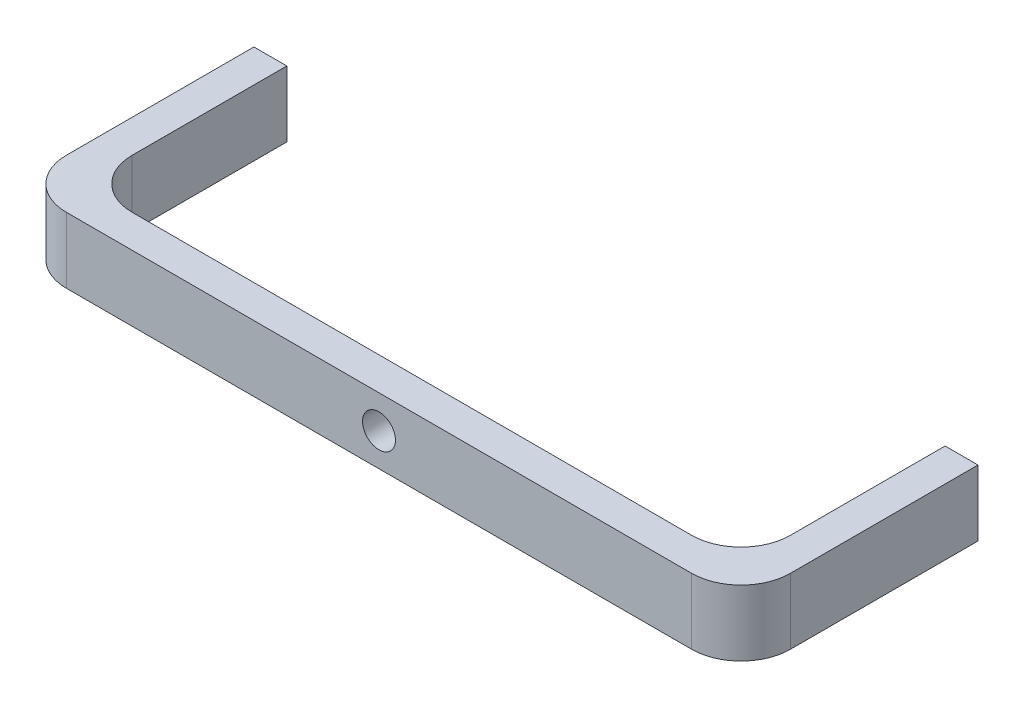
from build123d import *

# Parameters (mm, degrees)
BOSS_EXTRUDE1_DEPTH = 25.4
SKETCH2_R           = 6.35
CUT_EXTRUDE1_DEPTH  = 169.886126132
FILLET1_R           = 19.05


with BuildPart() as part:
    # Sketch1 → Boss-Extrude1 (new body)
    with BuildSketch(Plane(origin=(0, 0, 0), x_dir=(1, 0, 0), z_dir=(0, 1, 0))):
        Polygon((-127, 6.35), (127, 6.35), (127, 85.09), (139.7, 85.09), (139.7, -6.35), (127, -6.35), (-127, -6.35), (-139.7, -6.35), (-139.7, 85.09), (-127, 85.09), align=None)
    extrude(amount=BOSS_EXTRUDE1_DEPTH)

    # Sketch2 → Cut-Extrude1 (cut, through all)
    with BuildSketch(Plane.XY.offset(6.35)):
        with Locations((0, 12.7)):
            Circle(SKETCH2_R)
    extrude(amount=-CUT_EXTRUDE1_DEPTH, mode=Mode.SUBTRACT)

    # Fillet1
    fillet1_edges = [part.edges().sort_by_distance(p)[0] for p in [
        (-139.7, 12.7, 6.35),
        (-127, 12.7, -6.35),
        (127, 12.7, -6.35),
        (139.7, 12.7, 6.35),
    ]]
    fillet(fillet1_edges, radius=FILLET1_R)


solid = part.part
